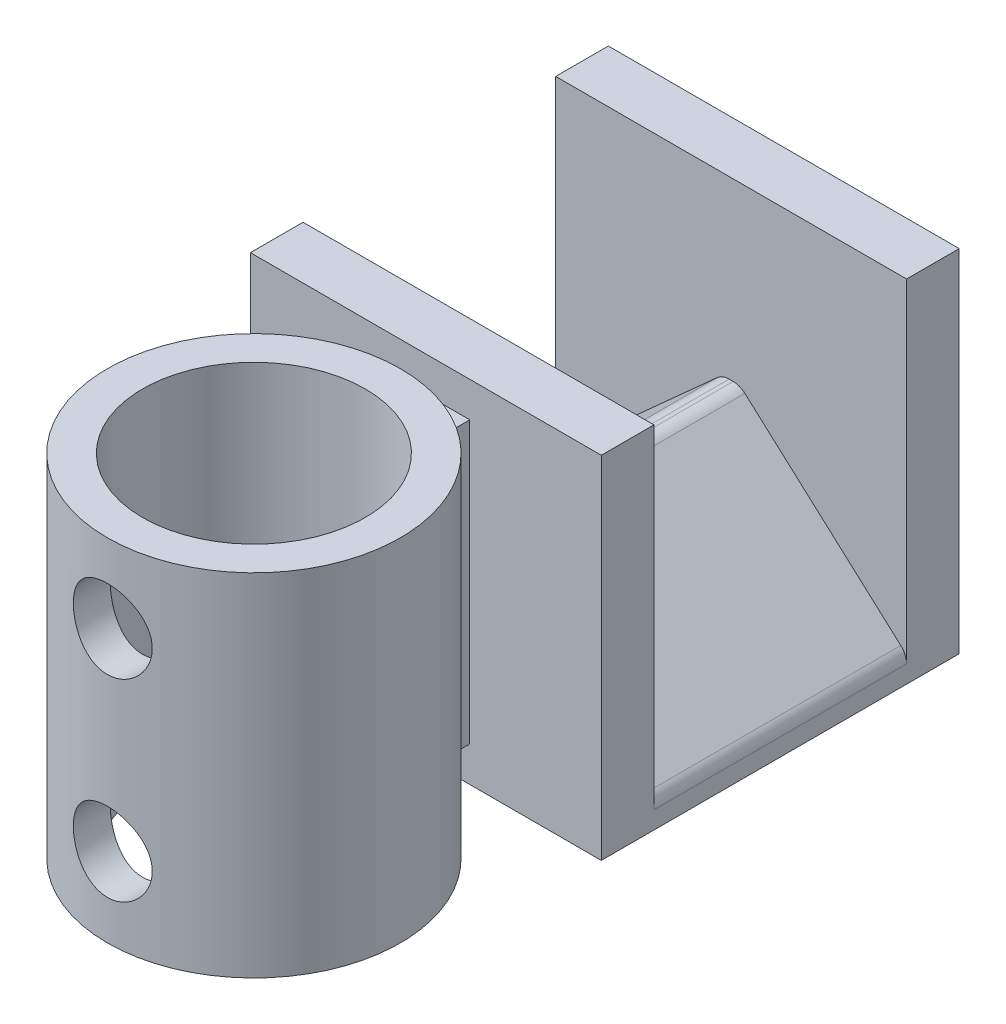
from build123d import *

# Parameters (mm, degrees)
SKETCH2_W                       = 20
SKETCH2_H                       = 10
BOSS_EXTRUDE1_DEPTH             = 7.2
CHAMFER1_SIZE                   = 9.5
CHAMFER1_SIZE2                  = 8.553838421
FILLET3_R                       = 1
SKETCH3_W                       = 20
SKETCH3_H                       = 20
BOSS_EXTRUDE2_DEPTH             = 3
BOSS_EXTRUDE3_REACH             = 22.713
SKETCH6_R                       = 8.35
SKETCH6_R_2                     = 6.35
BOSS_EXTRUDE3_DIRECTION_2_REACH = 22.713
BOSS_EXTRUDE4_REACH             = 29.224
BOSS_EXTRUDE4_END_RADIUS        = 8.35
SKETCH5_W                       = 5
SKETCH5_H                       = 16
CUT_EXTRUDE1_REACH              = 37.172
CUT_EXTRUDE1_END_RADIUS         = 8.35
SKETCH7_R                       = 2.25


with BuildPart() as part:
    # Sketch2 → Boss-Extrude1 (new, symmetric)
    with BuildSketch(Plane.XY):
        Rectangle(SKETCH2_W, SKETCH2_H)
    extrude(amount=BOSS_EXTRUDE1_DEPTH, both=True)

    # Chamfer1
    chamfer1_edges = [part.edges().sort_by_distance(p)[0] for p in [
        (-10, 5, 0),
        (10, 5, 0),
    ]]
    chamfer1_side = [part.faces().sort_by_distance(p)[0] for p in [
        (0, 5, 0),
    ]]
    chamfer(chamfer1_edges, length=CHAMFER1_SIZE, length2=CHAMFER1_SIZE2, reference=chamfer1_side[0])

    # Fillet3
    fillet3_edges = [part.edges().sort_by_distance(p)[0] for p in [
        (-0.5, 5, 0),
        (0.5, 5, 0),
        (10, -3.553838421, 0),
        (-10, -3.553838421, 0),
    ]]
    fillet(fillet3_edges, radius=FILLET3_R)

    # Sketch3 → Boss-Extrude2 (add)
    with BuildSketch(Plane.XY.offset(7.2)):
        with Locations((0, 5)):
            Rectangle(SKETCH3_W, SKETCH3_H)
    boss_extrude2 = extrude(amount=BOSS_EXTRUDE2_DEPTH)

    # Mirror1: Boss-Extrude2 across plane
    add(boss_extrude2.mirror(Plane.XY))


with BuildPart() as body_2:

    # Boss-Extrude3: up to this face of the body (flat: up to its plane)
    boss_extrude3_end = Plane(part.part.faces().sort_by_distance((0, 15, 8.7))[0])
    # Sketch6 → Boss-Extrude3 (new, up to the picked face)
    with BuildSketch(Plane(origin=(0, 0, 0), x_dir=(1, 0, 0), z_dir=(0, 1, 0)), mode=Mode.PRIVATE) as boss_extrude3_sk1:
        with Locations(Location((0, -20, 0), (0, 0, 90))):
            Circle(SKETCH6_R)
        with Locations(Location((0, -20, 0), (0, 0, 90))):
            Circle(SKETCH6_R_2, mode=Mode.SUBTRACT)
    boss_extrude3_tool1 = split(extrude(boss_extrude3_sk1.sketch, amount=BOSS_EXTRUDE3_REACH, mode=Mode.PRIVATE), bisect_by=boss_extrude3_end, keep=Keep.BOTH, mode=Mode.PRIVATE)
    add(boss_extrude3_tool1.solids().sort_by(Axis((0, 0, 28.113826), (0, 1, 0)))[0])


    # Boss-Extrude3 direction 2: up to this face of the body (flat: up to its plane)
    boss_extrude3_direction_2_end = Plane(part.part.faces().sort_by_distance((0, -5, 0))[0])
    # Sketch6 → Boss-Extrude3 direction 2 (add, up to the picked face)
    with BuildSketch(Plane(origin=(0, 0, 0), x_dir=(1, 0, 0), z_dir=(0, 1, 0)), mode=Mode.PRIVATE) as boss_extrude3_direction_2_sk1:
        with Locations(Location((0, -20, 0), (0, 0, 90))):
            Circle(SKETCH6_R)
        with Locations(Location((0, -20, 0), (0, 0, 90))):
            Circle(SKETCH6_R_2, mode=Mode.SUBTRACT)
    boss_extrude3_direction_2_tool1 = split(extrude(boss_extrude3_direction_2_sk1.sketch, amount=-BOSS_EXTRUDE3_DIRECTION_2_REACH, mode=Mode.PRIVATE), bisect_by=boss_extrude3_direction_2_end, keep=Keep.BOTH, mode=Mode.PRIVATE)
    add(boss_extrude3_direction_2_tool1.solids().sort_by(Axis((0, 0, 28.113826), (0, -1, 0)))[0])


with BuildPart() as part_1:
    add(part.part)

    add(body_2.part)  # Boss-Extrude4 merges body 2
    # Boss-Extrude4: up to this cylinder (the profile starts outside it)
    boss_extrude4_end = Plane(origin=(0, 5, 20), z_dir=(0, -1, 0)) * Cylinder(BOSS_EXTRUDE4_END_RADIUS, 76.148, mode=Mode.PRIVATE)
    # Sketch5 → Boss-Extrude4 (add, up to the surface)
    with BuildSketch(Plane.XY.offset(10.2), mode=Mode.PRIVATE) as boss_extrude4_sk1:
        with Locations((0, 5)):
            Rectangle(SKETCH5_W, SKETCH5_H)
    boss_extrude4_tool1 = extrude(boss_extrude4_sk1.sketch, amount=BOSS_EXTRUDE4_REACH, mode=Mode.PRIVATE) - boss_extrude4_end
    add(boss_extrude4_tool1.solids().sort_by_distance((0, 5, 10.2))[0])

    # Cut-Extrude1: up to this cylinder (the profile starts inside it)
    cut_extrude1_end = Plane(origin=(0, 5, 20), z_dir=(0, -1, 0)) * Cylinder(CUT_EXTRUDE1_END_RADIUS, 103.044, mode=Mode.PRIVATE)
    # Sketch7 → Cut-Extrude1 (cut, up to the surface)
    with BuildSketch(Plane.XY.offset(20), mode=Mode.PRIVATE) as cut_extrude1_sk1:
        with Locations(Location((0, 10.5, 0), (0, 0, 180))):
            Circle(SKETCH7_R)
    cut_extrude1_tool1 = extrude(cut_extrude1_sk1.sketch, amount=CUT_EXTRUDE1_REACH, mode=Mode.PRIVATE) & cut_extrude1_end
    add(cut_extrude1_tool1.solids().sort_by_distance((0, 10.5, 20))[0], mode=Mode.SUBTRACT)
    # Sketch7 → Cut-Extrude1 (cut, up to the surface)
    with BuildSketch(Plane.XY.offset(20), mode=Mode.PRIVATE) as cut_extrude1_sk2:
        with Locations(Location((0, -0.5, 0), (0, 0, 180))):
            Circle(SKETCH7_R)
    cut_extrude1_tool2 = extrude(cut_extrude1_sk2.sketch, amount=CUT_EXTRUDE1_REACH, mode=Mode.PRIVATE) & cut_extrude1_end
    add(cut_extrude1_tool2.solids().sort_by_distance((0, -0.5, 20))[0], mode=Mode.SUBTRACT)


solid = part_1.part
